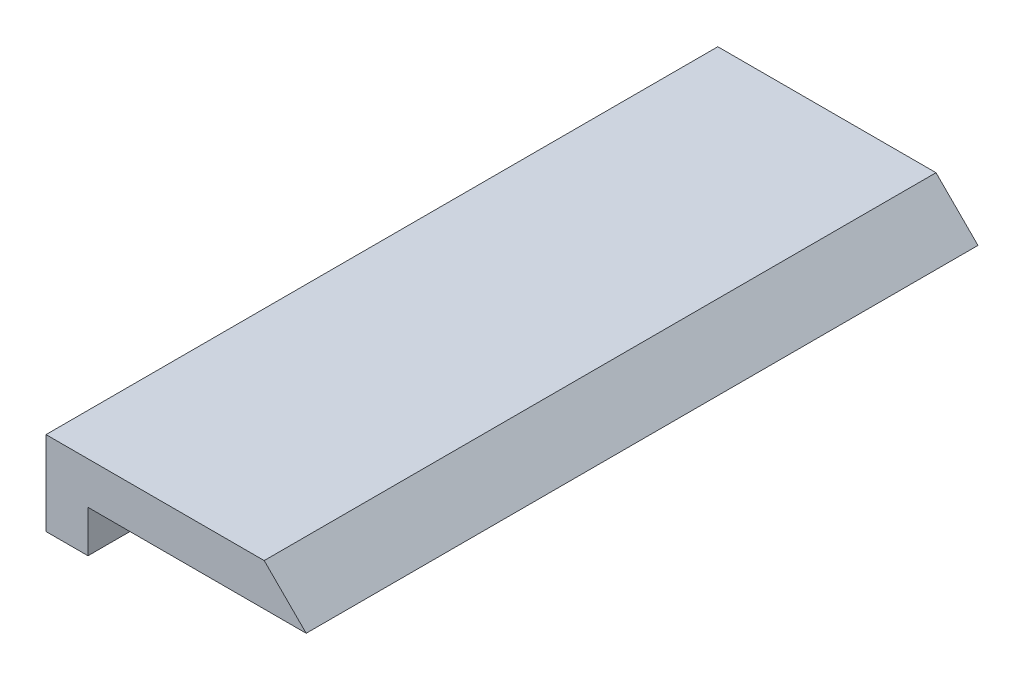
from build123d import *

# Parameters (mm, degrees)
BOSS_EXTRUDE1_DEPTH = 50.8


with BuildPart() as part:
    # Sketch1 → Boss-Extrude1 (new, symmetric)
    with BuildSketch(Plane.XY):
        Polygon((0, 0), (0, -6.35), (-6.35, -6.35), (-6.35, 6.35), (26.65, 6.35), (33, 0), align=None)
    extrude(amount=BOSS_EXTRUDE1_DEPTH, both=True)


solid = part.part
